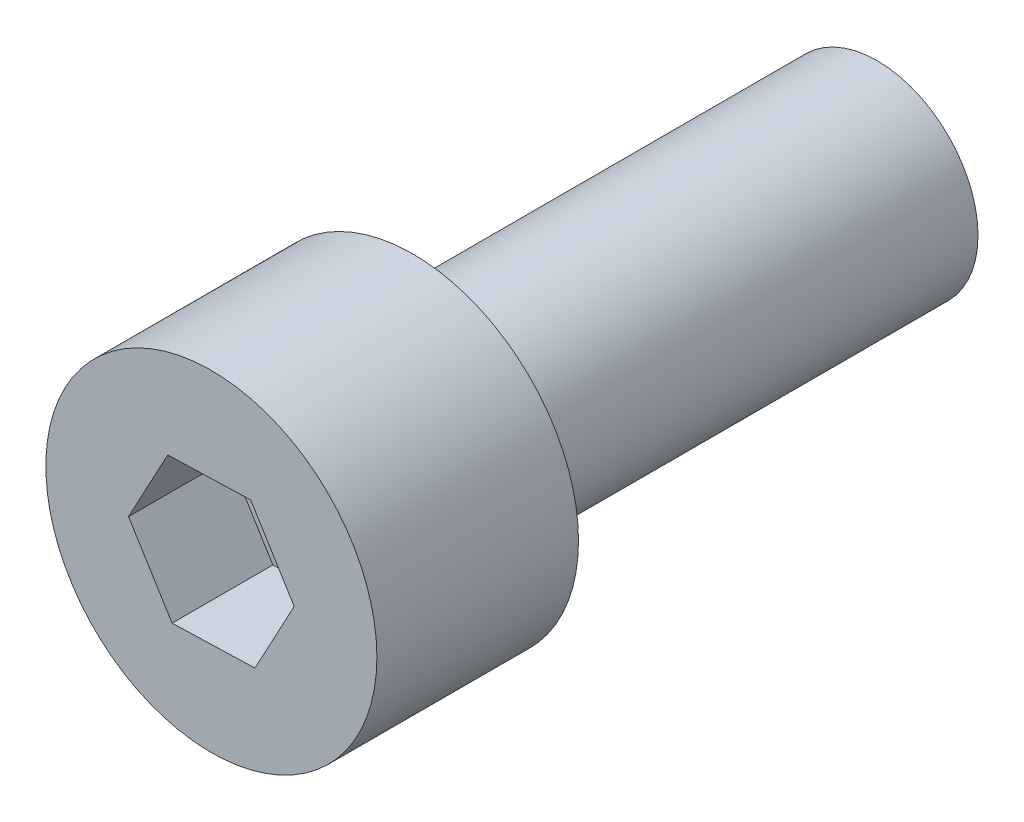
from build123d import *

# Parameters (mm, degrees)
SKETCH1_R           = 2.413
BOSS_EXTRUDE1_DEPTH = 11.1125
SKETCH2_R           = 3.9624
BOSS_EXTRUDE2_DEPTH = 4.826
CUT_EXTRUDE1_DEPTH  = 2.413


with BuildPart() as part:
    # Sketch1 → Boss-Extrude1 (new body)
    with BuildSketch(Plane.XY):
        Circle(SKETCH1_R)
    extrude(amount=BOSS_EXTRUDE1_DEPTH)

    # Sketch2 → Boss-Extrude2 (add)
    with BuildSketch(Plane.XY.offset(11.1125)):
        Circle(SKETCH2_R)
    extrude(amount=BOSS_EXTRUDE2_DEPTH)

    # Sketch3 → Cut-Extrude1 (cut)
    with BuildSketch(Plane.XY.offset(15.9385)):
        Polygon((0.940029384, 1.747595175), (-1.043447125, 1.687886915), (-1.98347651, -0.059708261), (-0.940029384, -1.747595175), (1.043447125, -1.687886915), (1.98347651, 0.059708261), align=None)
    extrude(amount=-CUT_EXTRUDE1_DEPTH, mode=Mode.SUBTRACT)


solid = part.part
